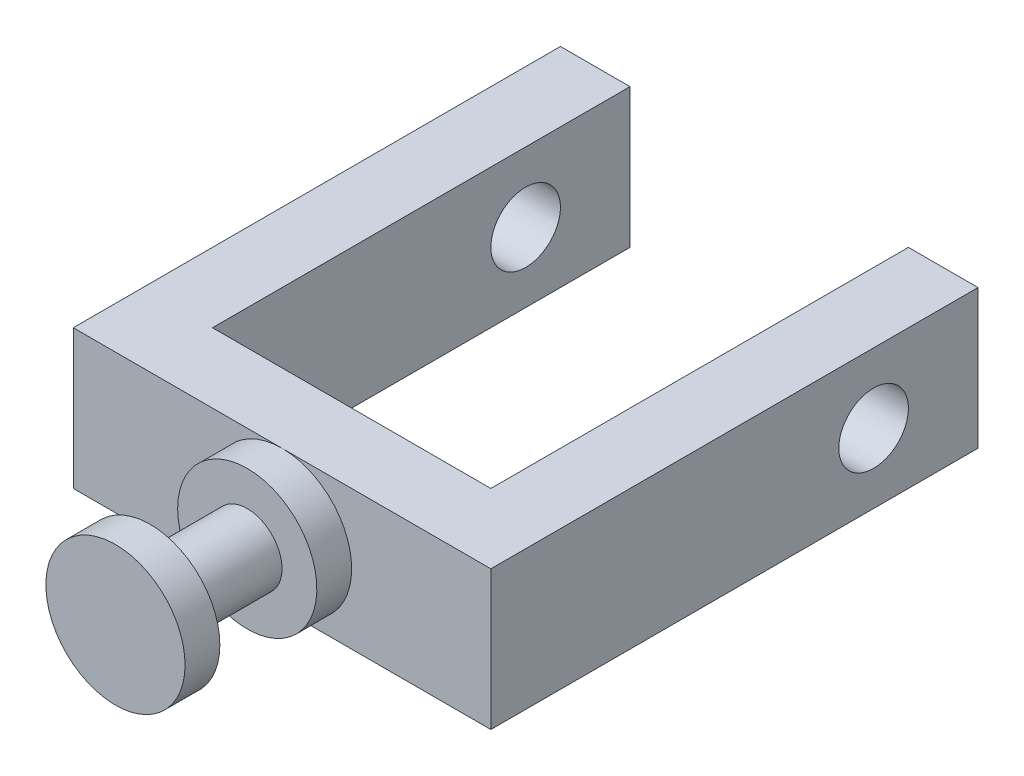
from build123d import *

# Parameters (mm, degrees)
SKETCH1_R               = 25.4
BOSS_EXTRUDE1_DEPTH     = 12.7
SKETCH2_R               = 12.7
BOSS_EXTRUDE2_DEPTH     = 35.4
SKETCH3_R               = 25.4
BOSS_EXTRUDE3_DEPTH     = 12.7
SKETCH4_W               = 152.4
SKETCH4_H               = 50.8
BOSS_EXTRUDE4_DEPTH     = 25.4
SKETCH5_W               = 25.4
SKETCH5_H               = 50.8
BOSS_EXTRUDE5_DEPTH     = 152.4
CUT_EXTRUDE1_DEPTH      = 285.254955981
CUT_EXTRUDE1_DEPTH_BACK = 285.254955981
SKETCH6_R               = 12.7


with BuildPart() as part:
    # Sketch1 → Boss-Extrude1 (new body)
    with BuildSketch(Plane.XY):
        Circle(SKETCH1_R)
    extrude(amount=-BOSS_EXTRUDE1_DEPTH)

    # Sketch2 → Boss-Extrude2 (add)
    with BuildSketch(Plane(origin=(0, 0, -12.7), x_dir=(-1, 0, 0), z_dir=(0, 0, -1))):
        Circle(SKETCH2_R)
    extrude(amount=BOSS_EXTRUDE2_DEPTH)

    # Sketch3 → Boss-Extrude3 (add)
    with BuildSketch(Plane(origin=(0, 0, -48.1), x_dir=(-1, 0, 0), z_dir=(0, 0, -1))):
        with Locations(Location((0, 0, 0), (0, 0, 180))):
            Circle(SKETCH3_R)
    extrude(amount=BOSS_EXTRUDE3_DEPTH)

    # Sketch4 → Boss-Extrude4 (add)
    with BuildSketch(Plane(origin=(0, 0, -60.8), x_dir=(-1, 0, 0), z_dir=(0, 0, -1))):
        Rectangle(SKETCH4_W, SKETCH4_H)
    extrude(amount=BOSS_EXTRUDE4_DEPTH)

    # Sketch5 → Boss-Extrude5 (add)
    with BuildSketch(Plane(origin=(0, 0, -86.2), x_dir=(-1, 0, 0), z_dir=(0, 0, -1))):
        with Locations((-63.5, 0)):
            Rectangle(SKETCH5_W, SKETCH5_H)
        with Locations((63.5, 0)):
            Rectangle(SKETCH5_W, SKETCH5_H)
    extrude(amount=BOSS_EXTRUDE5_DEPTH)

    # Sketch6 → Cut-Extrude1 (cut, two sides: drawn at the far end of the back side and taken through both)
    with BuildSketch(Plane.ZY.offset(76.2).offset(-CUT_EXTRUDE1_DEPTH_BACK)):
        with Locations((-200.5, 0)):
            Circle(SKETCH6_R)
    extrude(amount=CUT_EXTRUDE1_DEPTH + CUT_EXTRUDE1_DEPTH_BACK, mode=Mode.SUBTRACT)


solid = part.part
